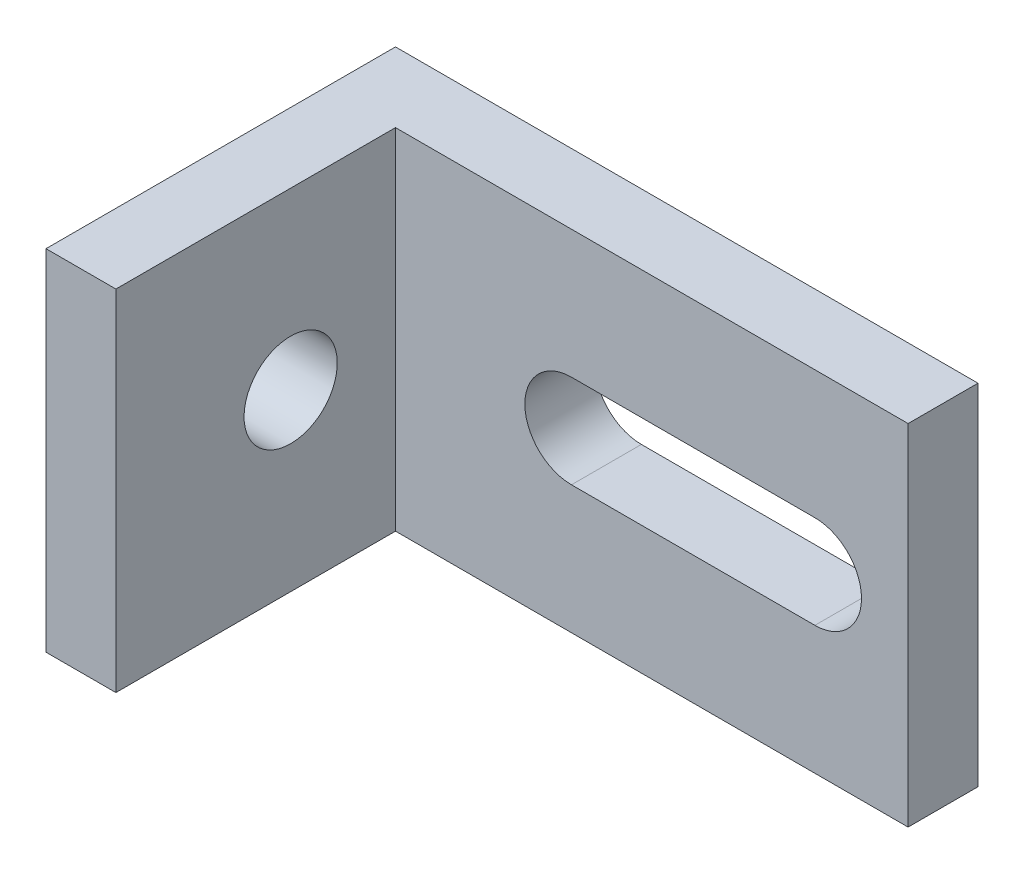
from build123d import *

# Parameters (mm, degrees)
SKETCH1_W           = 25
SKETCH1_H           = 15
BOSS_EXTRUDE1_DEPTH = 3
CUT_EXTRUDE1_DEPTH  = 3
SKETCH3_W           = 3
SKETCH3_H           = 15
BOSS_EXTRUDE2_DEPTH = 12
SKETCH4_R           = 2
CUT_EXTRUDE2_DEPTH  = 12


with BuildPart() as part:
    # Sketch1 → Boss-Extrude1 (new body)
    with BuildSketch(Plane.XY):
        Rectangle(SKETCH1_W, SKETCH1_H)
    extrude(amount=BOSS_EXTRUDE1_DEPTH)

    # Sketch2 → Cut-Extrude1 (cut)
    with BuildSketch(Plane.XY.offset(3)):
        with BuildLine():
            Line((8.5, -2), (-1.947413085, -2))
            ThreePointArc((-1.947413085, -2), (-3.947413085, 0), (-1.947413085, 2))
            Line((-1.947413085, 2), (8.5, 2))
            ThreePointArc((8.5, 2), (10.5, 0), (8.5, -2))
        make_face()
    extrude(amount=-CUT_EXTRUDE1_DEPTH, mode=Mode.SUBTRACT)

    # Sketch3 → Boss-Extrude2 (add)
    with BuildSketch(Plane.XY.offset(3)):
        with Locations((-11, 0)):
            Rectangle(SKETCH3_W, SKETCH3_H)
    extrude(amount=BOSS_EXTRUDE2_DEPTH)

    # Sketch4 → Cut-Extrude2 (cut)
    with BuildSketch(Plane.ZY.offset(12.5)):
        with Locations(Location((7.5, 0, 0), (0, 0, 270))):
            Circle(SKETCH4_R)
    extrude(amount=-CUT_EXTRUDE2_DEPTH, mode=Mode.SUBTRACT)


solid = part.part
